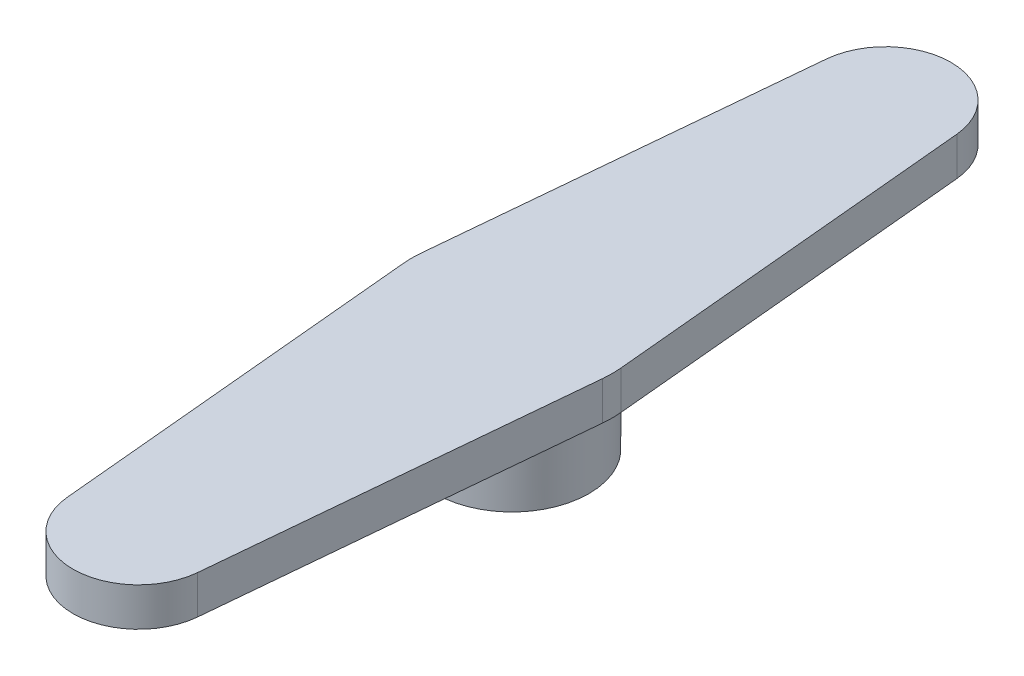
from build123d import *

# Parameters (mm, degrees)
SKETCH_1_R      = 4.25
SKETCH_1_R_2    = 6.5
EXTRUDE_1_DEPTH = 2.5
SKETCH_2_R      = 5
SKETCH_2_R_2    = 3.5
EXTRUDE_2_DEPTH = 5


with BuildPart() as part:
    # 스케치1 → 보스-돌출1 (new body)
    with BuildSketch(Plane(origin=(0, 0, 0), x_dir=(1, 0, 0), z_dir=(0, 1, 0))):
        with BuildLine():
            ThreePointArc((4.25, 24.25), (-0.19737792, 20.004585773), (-4.231666803, 24.644329897))
            Line((-4.231666803, 24.644329897), (-6.471960993, 0.603092784))
            ThreePointArc((-6.471960993, 0.603092784), (0, 6.5), (6.471960993, 0.603092784))
            Line((6.471960993, 0.603092784), (4.231666803, 24.644329897))
            ThreePointArc((4.231666803, 24.644329897), (4.245414227, 24.44737792), (4.25, 24.25))
        make_face()
        with Locations((0, 24.25)):
            Circle(SKETCH_1_R)
        Circle(SKETCH_1_R_2)
        with BuildLine():
            ThreePointArc((6.471960993, -0.603092784), (0, -6.5), (-6.471960993, -0.603092784))
            Line((-6.471960993, -0.603092784), (-4.231666803, -24.644329897))
            ThreePointArc((-4.231666803, -24.644329897), (-0.19737792, -20.004585773), (4.25, -24.25))
            ThreePointArc((4.25, -24.25), (4.245414227, -24.44737792), (4.231666803, -24.644329897))
            Line((4.231666803, -24.644329897), (6.471960993, -0.603092784))
        make_face()
        with Locations((0, -24.25)):
            Circle(SKETCH_1_R)
    extrude(amount=EXTRUDE_1_DEPTH)

    # 스케치2 → 보스-돌출2 (add)
    with BuildSketch(Plane.XZ):
        with Locations(Location((0, 0, 0), (0, 0, 90))):
            Circle(SKETCH_2_R)
        with Locations(Location((0, 0, 0), (0, 0, 270))):
            Circle(SKETCH_2_R_2, mode=Mode.SUBTRACT)
    extrude(amount=EXTRUDE_2_DEPTH)


solid = part.part
